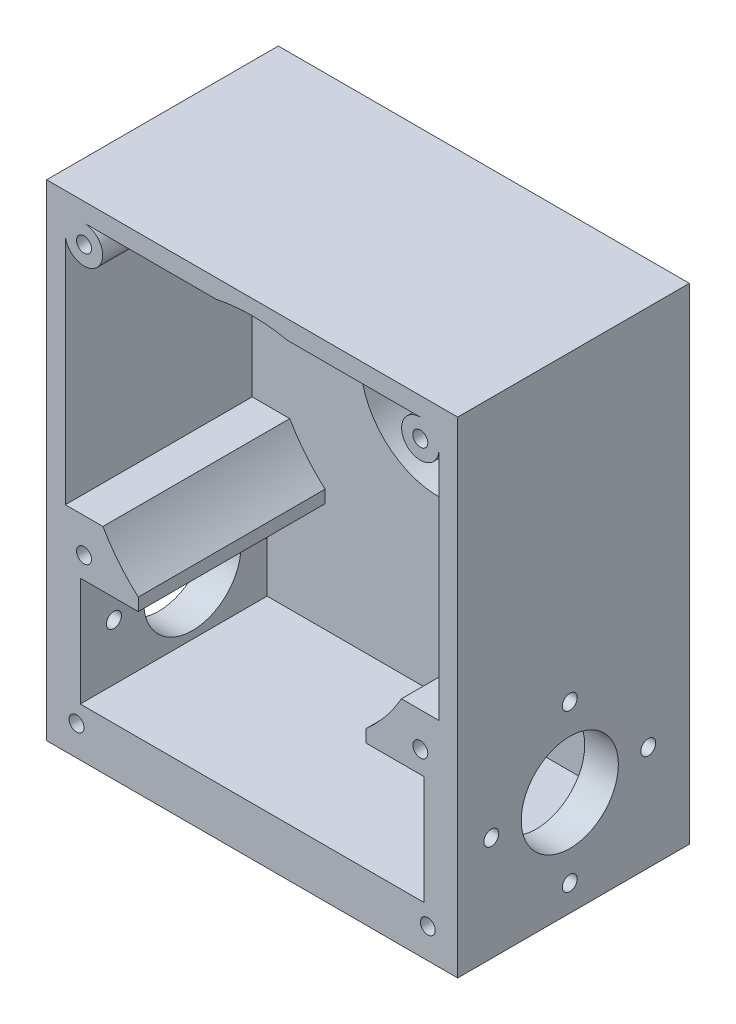
from build123d import *

# Parameters (mm, degrees)
SKETCH1_W            = 110
SKETCH1_H            = 130
BOSS_EXTRUDE1_DEPTH  = 5
SKETCH10_W           = 110
SKETCH10_H           = 60
BOSS_EXTRUDE4_DEPTH  = 13
SKETCH6_R            = 21
CUT_EXTRUDE2_DEPTH   = 30
BOSS_EXTRUDE8_DEPTH  = 50
SKETCH23_R           = 13
CUT_EXTRUDE5_DEPTH   = 130.464280788
SKETCH26_R           = 2
CUT_EXTRUDE8_DEPTH   = 10
CUT_EXTRUDE23_START  = -50
CUT_EXTRUDE23_DEPTH  = 50
SKETCH37_R           = 1.5
CUT_EXTRUDE25_DEPTH  = 4
BOSS_EXTRUDE10_START = 2
SKETCH39_W           = 110
SKETCH39_H           = 130
SKETCH39_R           = 21
SKETCH39_R_2         = 1.5
BOSS_EXTRUDE10_DEPTH = 2
SKETCH41_W           = 50
SKETCH41_H           = 29.177777778
CUT_EXTRUDE26_DEPTH  = 7
SKETCH43_R           = 2
CUT_EXTRUDE27_DEPTH  = 9


with BuildPart() as part:
    # Sketch1 → Boss-Extrude1 (new, symmetric)
    with BuildSketch(Plane.XY):
        with Locations((0, 5)):
            Rectangle(SKETCH1_W, SKETCH1_H)
    extrude(amount=BOSS_EXTRUDE1_DEPTH, both=True)

    # Sketch10 → Boss-Extrude4 (add)
    with BuildSketch(Plane.XZ.offset(60)):
        with Locations((0, 25)):
            Rectangle(SKETCH10_W, SKETCH10_H)
    extrude(amount=-BOSS_EXTRUDE4_DEPTH)

    # Sketch6 → Cut-Extrude2 (cut)
    with BuildSketch(Plane(origin=(0, 0, -5), x_dir=(-1, 0, 0), z_dir=(0, 0, -1))):
        with Locations((0, 20)):
            Circle(SKETCH6_R)
    extrude(amount=-CUT_EXTRUDE2_DEPTH, mode=Mode.SUBTRACT)

    # Sketch18 → Boss-Extrude8 (add)
    with BuildSketch(Plane.XY.offset(5)):
        with BuildLine():
            Line((-55, -47), (-39, -47))
            Line((-39, -47), (-39, -17.822222222))
            Line((-39, -17.822222222), (-30.482216757, -17.822222222))
            Line((-30.482216757, -17.822222222), (-30.482216757, -14.450463881))
            ThreePointArc((-30.482216757, -14.450463881), (0, 66), (30.482216757, -14.450463881))
            Line((30.482216757, -14.450463881), (30.482216757, -17.822222222))
            Line((30.482216757, -17.822222222), (39, -17.822222222))
            Line((39, -17.822222222), (39, -47))
            Line((39, -47), (55, -47))
            Line((55, -47), (55, 70))
            Line((55, 70), (-55, 70))
            Line((-55, 70), (-55, -47))
        make_face()
    extrude(amount=BOSS_EXTRUDE8_DEPTH)

    # Sketch23 → Cut-Extrude5 (cut, through all)
    with BuildSketch(Plane(origin=(-39, 0, 0), x_dir=(0, 0, -1), z_dir=(1, 0, 0))):
        with Locations((-25, -32)):
            Circle(SKETCH23_R)
    cut_extrude5 = extrude(amount=-CUT_EXTRUDE5_DEPTH, mode=Mode.SUBTRACT)

    # Sketch26 → Cut-Extrude8 (cut)
    with BuildSketch(Plane.XY.offset(55)):
        with Locations((-45, 60)):
            Circle(SKETCH26_R)
        with Locations(Location((45, 60, 0), (0, 0, 180))):
            Circle(SKETCH26_R)
        with Locations((-47, -52)):
            Circle(SKETCH26_R)
        with Locations(Location((47, -52, 0), (0, 0, 180))):
            Circle(SKETCH26_R)
        with Locations((-45, -12)):
            Circle(SKETCH26_R)
        with Locations((45, -12)):
            Circle(SKETCH26_R)
    extrude(amount=-CUT_EXTRUDE8_DEPTH, mode=Mode.SUBTRACT)

    # Sketch31 → Cut-Extrude23 (cut)
    with BuildSketch(Plane.XY.offset(55).offset(CUT_EXTRUDE23_START)):
        with BuildLine():
            Line((-9.539392014, 65), (-45, 65))
            ThreePointArc((-45, 65), (-41.464466094, 63.535533906), (-40, 60))
            ThreePointArc((-40, 60), (-45, 55), (-50, 60))
            Line((-50, 60), (-50, -2.822222222))
            Line((-50, -2.822222222), (-39.939281076, -2.822222222))
            ThreePointArc((-39.939281076, -2.822222222), (-41.976162634, 38.814934773), (-9.539392014, 65))
        make_face()
        with BuildLine():
            Line((9.539392014, 65), (-9.539392014, 65))
            ThreePointArc((-9.539392014, 65), (-41.976162634, 38.814934773), (-39.939281076, -2.822222222))
            Line((-39.939281076, -2.822222222), (39.939281076, -2.822222222))
            ThreePointArc((39.939281076, -2.822222222), (41.976162634, 38.814934773), (9.539392014, 65))
        make_face()
        with BuildLine():
            Line((45, 65), (9.539392014, 65))
            ThreePointArc((9.539392014, 65), (41.976162634, 38.814934773), (39.939281076, -2.822222222))
            Line((39.939281076, -2.822222222), (50, -2.822222222))
            Line((50, -2.822222222), (50, 60))
            ThreePointArc((50, 60), (41.464466094, 56.464466094), (45, 65))
        make_face()
    extrude(amount=CUT_EXTRUDE23_DEPTH, mode=Mode.SUBTRACT)

    # Sketch37 → Cut-Extrude25 (cut)
    with BuildSketch(Plane(origin=(0, 0, -5), x_dir=(-1, 0, 0), z_dir=(0, 0, -1))):
        with Locations((-17, 37)):
            Circle(SKETCH37_R)
        with Locations(Location((17, 37, 0), (0, 0, 180))):
            Circle(SKETCH37_R)
        with Locations(Location((-17, 3, 0), (0, 0, 180))):
            Circle(SKETCH37_R)
        with Locations((17, 3)):
            Circle(SKETCH37_R)
    extrude(amount=-CUT_EXTRUDE25_DEPTH, mode=Mode.SUBTRACT)

    # Sketch39 → Boss-Extrude10 (add)
    with BuildSketch(Plane(origin=(0, 0, -5), x_dir=(-1, 0, 0), z_dir=(0, 0, -1)).offset(BOSS_EXTRUDE10_START)):
        with Locations((0, 5)):
            Rectangle(SKETCH39_W, SKETCH39_H)
        with Locations((0, 20)):
            Circle(SKETCH39_R, mode=Mode.SUBTRACT)
        with Locations((-17, 37)):
            Circle(SKETCH39_R_2, mode=Mode.SUBTRACT)
        with Locations((17, 37)):
            Circle(SKETCH39_R_2, mode=Mode.SUBTRACT)
        with Locations((17, 3)):
            Circle(SKETCH39_R_2, mode=Mode.SUBTRACT)
        with Locations((-17, 3)):
            Circle(SKETCH39_R_2, mode=Mode.SUBTRACT)
    extrude(amount=-BOSS_EXTRUDE10_DEPTH)

    # Sketch41 → Cut-Extrude26 (cut)
    with BuildSketch(Plane(origin=(-39, 0, 0), x_dir=(0, 0, -1), z_dir=(1, 0, 0))):
        with Locations((-30, -32.411111111)):
            Rectangle(SKETCH41_W, SKETCH41_H)
    cut_extrude26 = extrude(amount=-CUT_EXTRUDE26_DEPTH, mode=Mode.SUBTRACT)

    # Mirror1: Cut-Extrude26 across plane
    add(cut_extrude26.mirror(Plane(origin=(0, 0, 0), x_dir=(0, 0, 1), z_dir=(1, 0, 0))), mode=Mode.SUBTRACT)

    # Mirror2: Cut-Extrude5 across plane
    add(cut_extrude5.mirror(Plane(origin=(0, 0, 0), x_dir=(0, 0, 1), z_dir=(1, 0, 0))), mode=Mode.SUBTRACT)

    # Sketch43 → Cut-Extrude27 (cut)
    with BuildSketch(Plane(origin=(55, 0, 0), x_dir=(0, 0, -1), z_dir=(1, 0, 0))):
        with Locations((-25, -11)):
            Circle(SKETCH43_R)
        with Locations((-4, -32)):
            Circle(SKETCH43_R)
        with Locations((-25, -53)):
            Circle(SKETCH43_R)
        with Locations((-46, -32)):
            Circle(SKETCH43_R)
    cut_extrude27 = extrude(amount=-CUT_EXTRUDE27_DEPTH, mode=Mode.SUBTRACT)

    # Mirror3: Cut-Extrude27 across plane
    add(cut_extrude27.mirror(Plane(origin=(0, 0, 0), x_dir=(0, 0, 1), z_dir=(1, 0, 0))), mode=Mode.SUBTRACT)


solid = part.part
